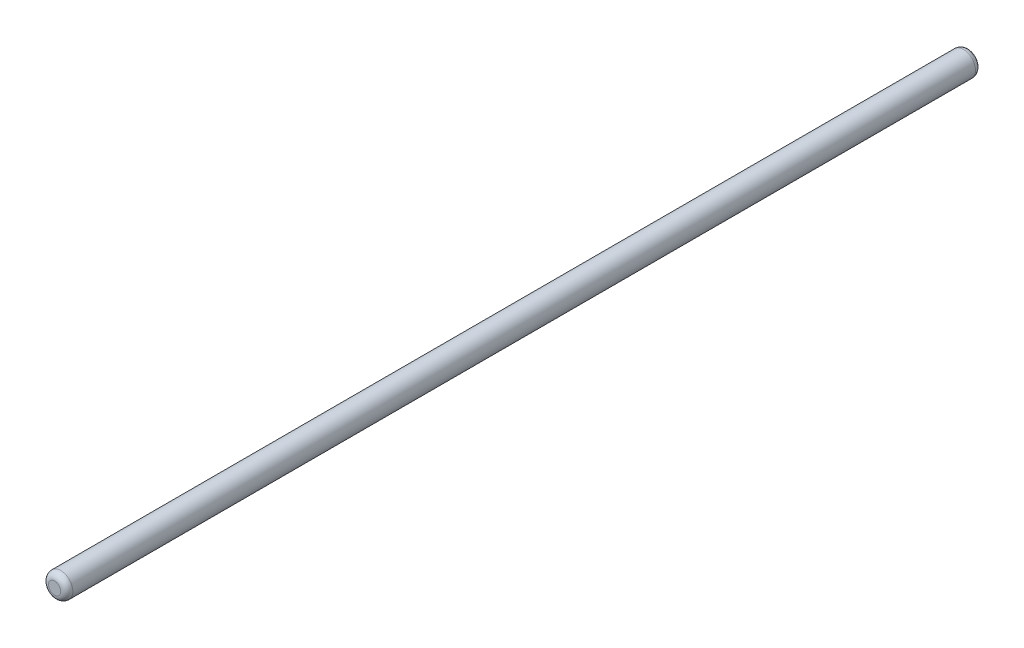
from build123d import *

# Parameters (mm, degrees)
SKETCH1_R           = 4
BOSS_EXTRUDE1_DEPTH = 300
FILLET1_R           = 2


with BuildPart() as part:
    # Sketch1 → Boss-Extrude1 (new body)
    with BuildSketch(Plane.XY):
        Circle(SKETCH1_R)
    extrude(amount=BOSS_EXTRUDE1_DEPTH)

    # Fillet1
    fillet1_edges = [part.edges().sort_by_distance(p)[0] for p in [
        (-4, 0, 0),
        (-4, 0, 300),
    ]]
    fillet(fillet1_edges, radius=FILLET1_R)


solid = part.part
